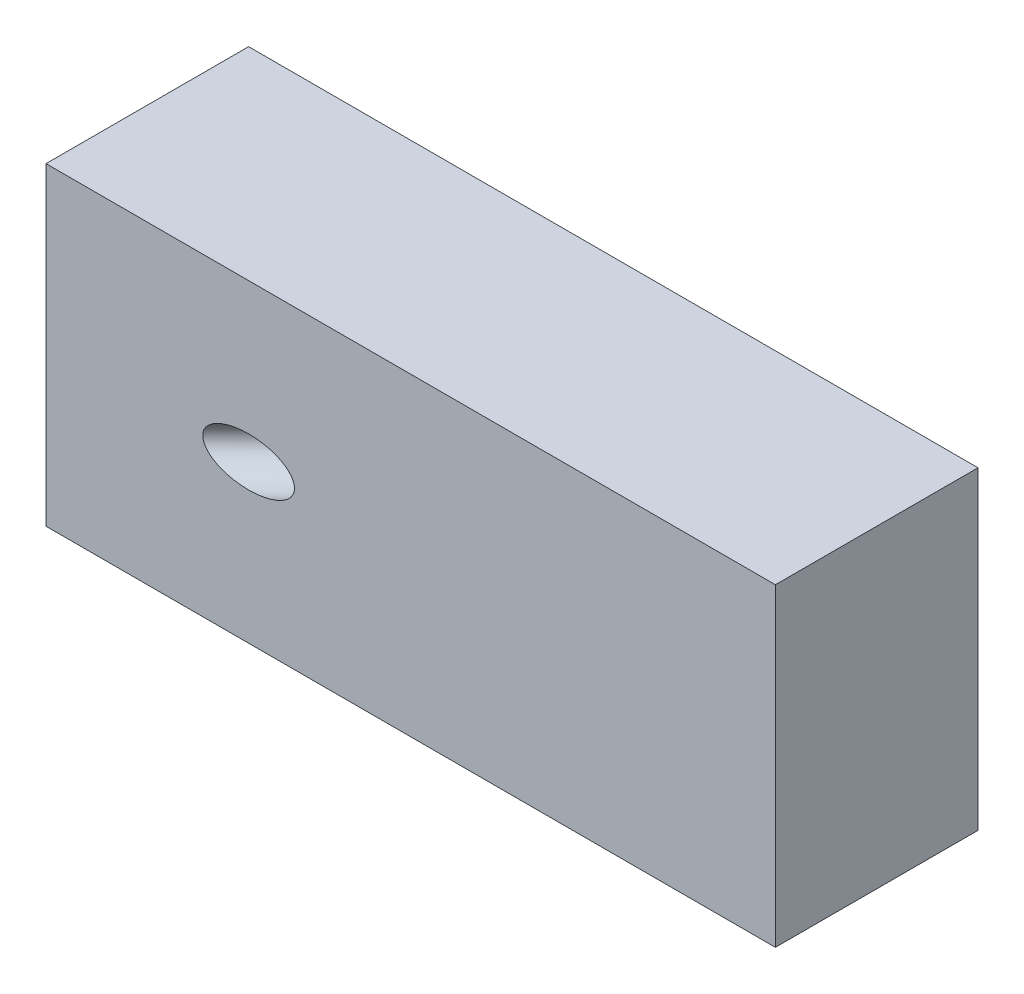
from build123d import *
from build123d.topology import SkipClean

# Parameters (mm, degrees)
ESQUISSE1_W                  = 18
ESQUISSE1_H                  = 7.75
BOSS_EXTRU_1_DEPTH           = 5
ENL_V_MAT_EXTRU_1_DEPTH      = 15
ENL_V_MAT_EXTRU_1_DEPTH_BACK = 10
ESQUISSE13_RX                = 0.8
ESQUISSE13_RY                = 0.6
ESQUISSE15_R                 = 0.5
BOSS_EXTRU_3_DEPTH           = 0.55
BOSS_EXTRU_4_DEPTH           = 1.1


with BuildPart() as part:
    # Esquisse1 → Boss.-Extru.1 (new body)
    with BuildSketch(Plane.XY):
        with Locations((9, 3.875)):
            Rectangle(ESQUISSE1_W, ESQUISSE1_H)
    extrude(amount=BOSS_EXTRU_1_DEPTH)

    # Esquisse13 → Enlèv. mat.-Extru.1 (cut, two sides: drawn at the far end of the back side and taken through both)
    with BuildSketch(Plane(origin=(5, 3.875, 5), x_dir=(-0.7071067811865476, 0, -0.7071067811865475), z_dir=(0.7071067811865475, 0, -0.7071067811865476)).offset(-ENL_V_MAT_EXTRU_1_DEPTH_BACK)):
        with Locations(Location((0, 0), (0, 0, 0))):
            Ellipse(ESQUISSE13_RX, ESQUISSE13_RY)
    extrude(amount=ENL_V_MAT_EXTRU_1_DEPTH + ENL_V_MAT_EXTRU_1_DEPTH_BACK, mode=Mode.SUBTRACT)

    # Esquisse15 → Boss.-Extru.3 (add)
    with BuildSketch(Plane(origin=(0, 0, 0), x_dir=(-1, 0, 0), z_dir=(0, 0, -1))):
        with Locations((-11.979236125, 2.375)):
            Circle(ESQUISSE15_R)
        with Locations((-11.979236125, 5.375)):
            Circle(ESQUISSE15_R)
    extrude(amount=BOSS_EXTRU_3_DEPTH)

    # Esquisse16 → Boss.-Extru.4 (add)
    with SkipClean():  # the faces are left unmerged after this step: merging them gives an invalid solid
        with BuildSketch(Plane(origin=(0, 0, 0), x_dir=(-1, 0, 0), z_dir=(0, 0, -1))):
            with BuildLine():
                Line((-12.479236125, 2.375), (-12.479236125, 5.375))
                ThreePointArc((-12.479236125, 5.375), (-11.979236125, 5.875), (-11.479236125, 5.375))
                Line((-11.479236125, 5.375), (-11.479236125, 2.375))
                ThreePointArc((-11.479236125, 2.375), (-11.979236125, 1.875), (-12.479236125, 2.375))
            make_face()
        extrude(amount=BOSS_EXTRU_4_DEPTH)


solid = part.part
